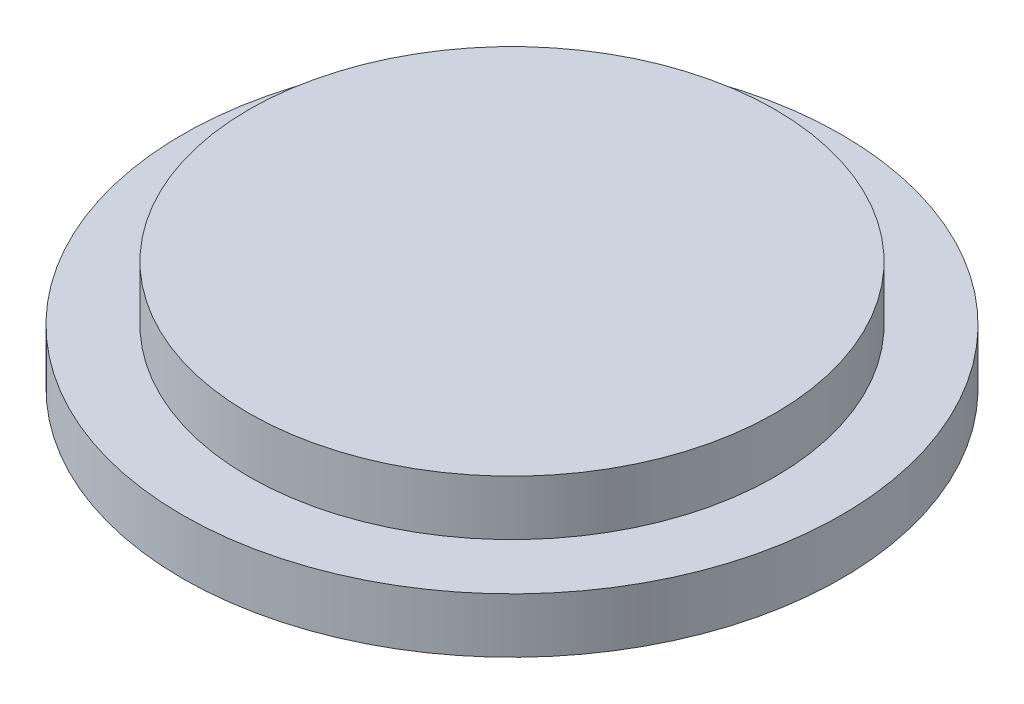
from build123d import *

# Parameters (mm, degrees)
ESQUISSE1_R        = 47.9
BOSS_EXTRU_1_DEPTH = 10
ESQUISSE2_R        = 60
BOSS_EXTRU_2_DEPTH = 10


with BuildPart() as part:
    # Esquisse1 → Boss.-Extru.1 (new body)
    with BuildSketch(Plane(origin=(0, 0, 0), x_dir=(1, 0, 0), z_dir=(0, 1, 0))):
        with Locations(Location((0, 0, 0), (0, 0, 270))):
            Circle(ESQUISSE1_R)
    extrude(amount=BOSS_EXTRU_1_DEPTH)

    # Esquisse2 → Boss.-Extru.2 (add)
    with BuildSketch(Plane.XZ):
        with Locations(Location((0, 0, 0), (0, 0, 270))):
            Circle(ESQUISSE2_R)
    extrude(amount=BOSS_EXTRU_2_DEPTH)


solid = part.part
